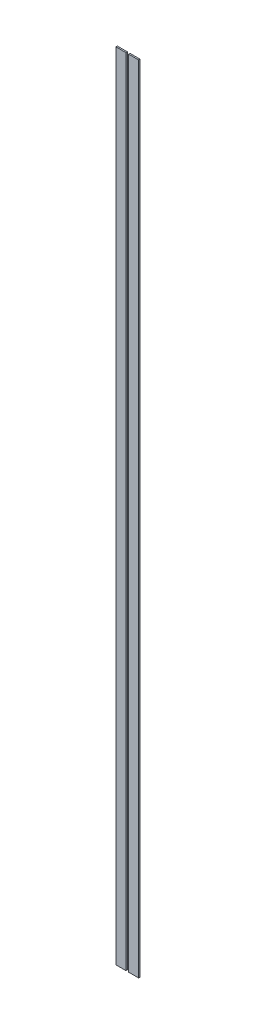
from build123d import *

# Parameters (mm, degrees)
ESQUISSE1_W        = 7
ESQUISSE1_H        = 560
EXTRUSION1_DEPTH   = 1
EXTRUSION1_2_DEPTH = 1


with BuildPart() as part:
    # Esquisse1 → Extrusion1 (new body)
    with BuildSketch(Plane.XY):
        with Locations((4.5, 0)):
            Rectangle(ESQUISSE1_W, ESQUISSE1_H)
    extrude(amount=EXTRUSION1_DEPTH)


with BuildPart() as body_2:
    # Esquisse1 → Extrusion1 2 (new body)
    with BuildSketch(Plane.XY):
        with Locations((-4.5, 0)):
            Rectangle(ESQUISSE1_W, ESQUISSE1_H)
    extrude(amount=EXTRUSION1_2_DEPTH)


solid = Compound([part.part, body_2.part])
